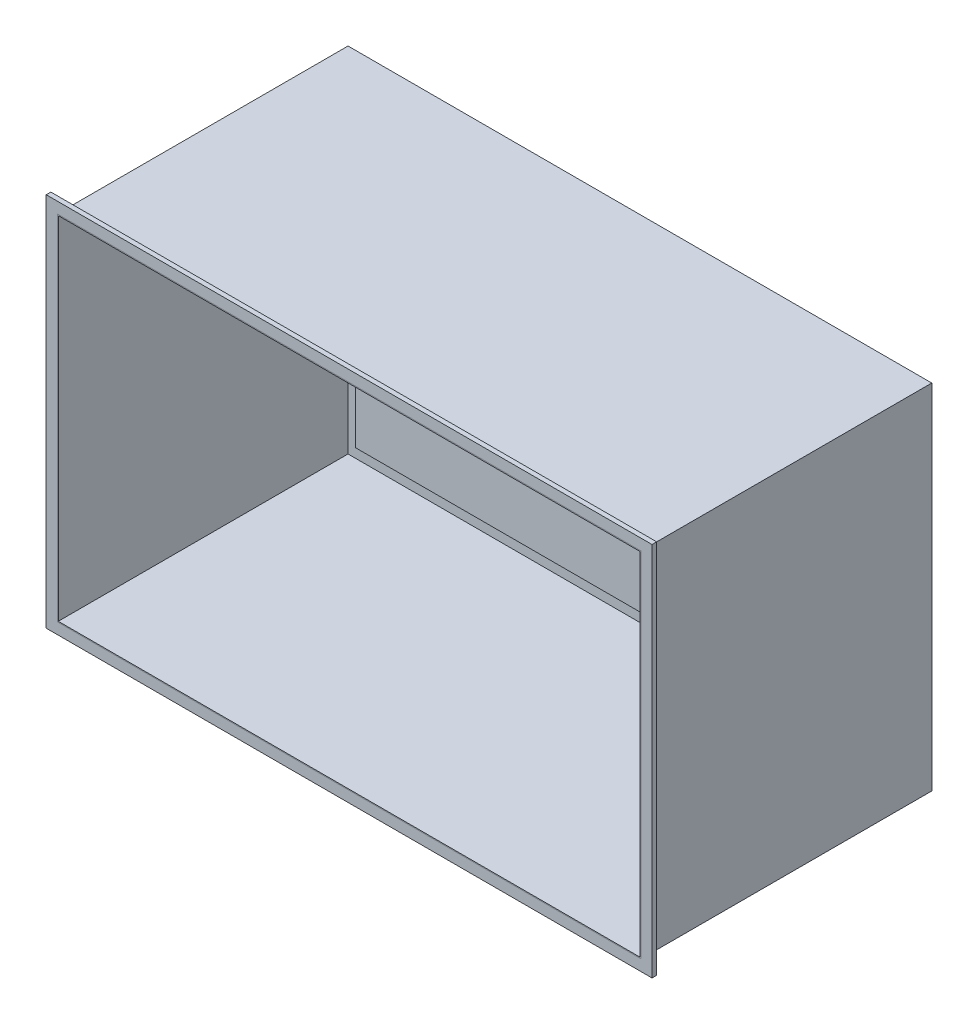
from build123d import *

# Parameters (mm, degrees)
CROQUIS1_W              = 793
CROQUIS1_H              = 440
SALIENTE_EXTRUIR1_DEPTH = 480
VACIADO1_T              = -1.36
CROQUIS2_R              = 12.7
CORTAR_EXTRUIR1_DEPTH   = 80
CROQUIS3_R              = 6.35
CORTAR_EXTRUIR2_DEPTH   = 10
CROQUIS5_R              = 6.35
CORTAR_EXTRUIR4_DEPTH   = 10
CROQUIS8_R              = 12.7
CORTAR_EXTRUIR6_DEPTH   = 10
CROQUIS9_W              = 25.745560897
CROQUIS9_H              = 149.422371693
SALIENTE_EXTRUIR2_DEPTH = 1.36
CROQUIS18_R             = 3.175
CROQUIS18_R_2           = 5.554937391
CORTAR_EXTRUIR12_DEPTH  = 10
CROQUIS19_W             = 793
CROQUIS19_H             = 480
CORTAR_EXTRUIR13_DEPTH  = 45
CROQUIS20_W             = 40.222844752
CROQUIS20_H             = 335.190372933
SALIENTE_EXTRUIR3_DEPTH = 1.36
CROQUIS22_W             = 754.715939893
CROQUIS22_H             = 447.32434432
SALIENTE_EXTRUIR4_DEPTH = 7
CROQUIS23_W             = 823
CROQUIS23_H             = 510
CROQUIS23_W_2           = 793
CROQUIS23_H_2           = 480
SALIENTE_EXTRUIR5_DEPTH = 6.31
CROQUIS24_R             = 12.7
CORTAR_EXTRUIR14_DEPTH  = 10


with BuildPart() as part:
    # Croquis1 → Saliente-Extruir1 (new body)
    with BuildSketch(Plane(origin=(0, 0, 0), x_dir=(1, 0, 0), z_dir=(0, 1, 0))):
        Rectangle(CROQUIS1_W, CROQUIS1_H)
    extrude(amount=SALIENTE_EXTRUIR1_DEPTH)

    # Vaciado1
    vaciado1_openings = [part.faces().sort_by_distance(p)[0] for p in [
        (0, 240, 220),
    ]]
    offset(amount=VACIADO1_T, openings=vaciado1_openings, kind=Kind.INTERSECTION)

    # Croquis2 → Cortar-Extruir1 (cut)
    with BuildSketch(Plane.XZ):
        with Locations(Location((-340.681431581, 41.288678468, 0), (0, 0, 270))):
            Circle(CROQUIS2_R)
    cortar_extruir1 = extrude(amount=-CORTAR_EXTRUIR1_DEPTH, mode=Mode.SUBTRACT)

    # Croquis3 → Cortar-Extruir2 (cut)
    with BuildSketch(Plane.XZ):
        with Locations(Location((-340.681431581, 81.288678468, 0), (0, 0, 270))):
            Circle(CROQUIS3_R)
    cortar_extruir2 = extrude(amount=-CORTAR_EXTRUIR2_DEPTH, mode=Mode.SUBTRACT)

    # Croquis5 → Cortar-Extruir4 (cut)
    with BuildSketch(Plane.XZ):
        with Locations(Location((-340.681431581, 121.288678468, 0), (0, 0, 270))):
            Circle(CROQUIS5_R)
    cortar_extruir4 = extrude(amount=-CORTAR_EXTRUIR4_DEPTH, mode=Mode.SUBTRACT)

    # Simetría1: Cortar-Extruir1, Cortar-Extruir2, Cortar-Extruir4 across plane
    add(cortar_extruir1.mirror(Plane(origin=(0, 0, 0), x_dir=(0, 0, 1), z_dir=(1, 0, 0))), mode=Mode.SUBTRACT)
    add(cortar_extruir2.mirror(Plane(origin=(0, 0, 0), x_dir=(0, 0, 1), z_dir=(1, 0, 0))), mode=Mode.SUBTRACT)
    add(cortar_extruir4.mirror(Plane(origin=(0, 0, 0), x_dir=(0, 0, 1), z_dir=(1, 0, 0))), mode=Mode.SUBTRACT)

    # Croquis8 → Cortar-Extruir6 (cut)
    with BuildSketch(Plane.XZ):
        with Locations(Location((340.681431581, -121.411321532, 0), (0, 0, 270))):
            Circle(CROQUIS8_R)
    extrude(amount=-CORTAR_EXTRUIR6_DEPTH, mode=Mode.SUBTRACT)

    # Croquis9 → Saliente-Extruir2 (add)
    with BuildSketch(Plane(origin=(0, 1.36, 0), x_dir=(1, 0, 0), z_dir=(0, 1, 0))):
        with Locations((-340.681431581, -81.288678468)):
            Rectangle(CROQUIS9_W, CROQUIS9_H)
    extrude(amount=-SALIENTE_EXTRUIR2_DEPTH)

    # Croquis18 → Cortar-Extruir12 (cut)
    with BuildSketch(Plane.XY.offset(-218.64)):
        with Locations((-348, 438)):
            Circle(CROQUIS18_R)
        with Locations((0, 438)):
            Circle(CROQUIS18_R)
        with Locations((348, 438)):
            Circle(CROQUIS18_R)
        with Locations((348, 240)):
            Circle(CROQUIS18_R)
        with Locations((348, 42)):
            Circle(CROQUIS18_R)
        with Locations((0, 42)):
            Circle(CROQUIS18_R)
        with Locations((-348, 42)):
            Circle(CROQUIS18_R)
        with Locations((-348, 240)):
            Circle(CROQUIS18_R_2)
    extrude(amount=-CORTAR_EXTRUIR12_DEPTH, mode=Mode.SUBTRACT)

    # Croquis19 → Cortar-Extruir13 (cut)
    with BuildSketch(Plane.XY.offset(220)):
        with Locations((0, 240)):
            Rectangle(CROQUIS19_W, CROQUIS19_H)
    extrude(amount=-CORTAR_EXTRUIR13_DEPTH, mode=Mode.SUBTRACT)

    # Croquis20 → Saliente-Extruir3 (add)
    with BuildSketch(Plane.XZ):
        with Locations((336.531134424, -29.98561058)):
            Rectangle(CROQUIS20_W, CROQUIS20_H)
    extrude(amount=-SALIENTE_EXTRUIR3_DEPTH)

    # Croquis22 → Saliente-Extruir4 (add)
    with BuildSketch(Plane(origin=(0, 0, -220), x_dir=(-1, 0, 0), z_dir=(0, 0, -1))):
        with Locations((2.077532213, 243.10690677)):
            Rectangle(CROQUIS22_W, CROQUIS22_H)
    extrude(amount=-SALIENTE_EXTRUIR4_DEPTH)

    # Croquis24 → Cortar-Extruir14 (cut)
    with BuildSketch(Plane.XZ):
        with Locations(Location((372.5, -117.8, 0), (0, 0, 270))):
            Circle(CROQUIS24_R)
        with Locations(Location((372.5, -67.4, 0), (0, 0, 270))):
            Circle(CROQUIS24_R)
        with Locations(Location((372.5, -17, 0), (0, 0, 270))):
            Circle(CROQUIS24_R)
    extrude(amount=-CORTAR_EXTRUIR14_DEPTH, mode=Mode.SUBTRACT)


with BuildPart() as body_2:
    # Croquis23 → Saliente-Extruir5 (new body)
    with BuildSketch(Plane.XY.offset(175)):
        with Locations((0, 240)):
            Rectangle(CROQUIS23_W, CROQUIS23_H)
        with Locations((0, 240)):
            Rectangle(CROQUIS23_W_2, CROQUIS23_H_2, mode=Mode.SUBTRACT)
    extrude(amount=-SALIENTE_EXTRUIR5_DEPTH)


solid = Compound([part.part, body_2.part])
